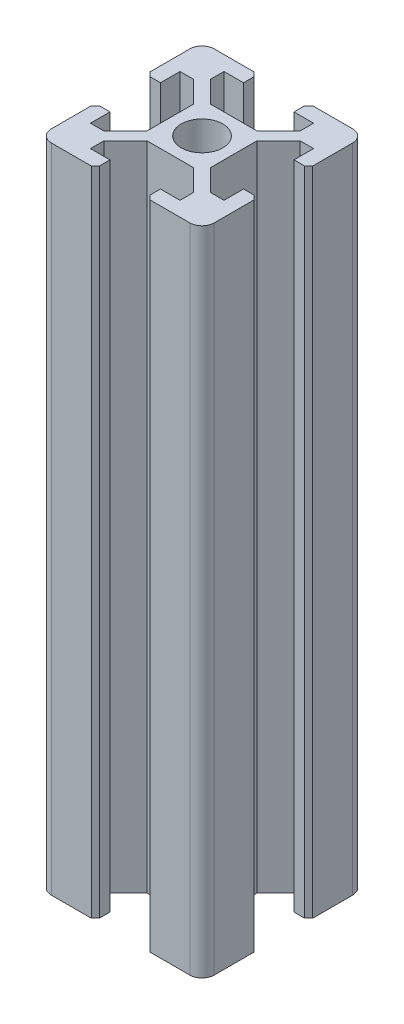
from build123d import *

# Parameters (mm, degrees)
EXTRUDE_2_DEPTH     = 80
SKETCH_4_R          = 2.55
CUT_EXTRUDE_2_DEPTH = 85.852813742


with BuildPart() as part:
    # 草图1 → 凸台-拉伸2 (new body)
    with BuildSketch(Plane(origin=(0, 0, 0), x_dir=(1, 0, 0), z_dir=(0, 1, 0))):
        with BuildLine():
            Line((13.9, 12.839339828), (13.9, 7.160660172))
            Line((13.9, 7.160660172), (16.560660172, 4.5))
            Line((16.560660172, 4.5), (18.2, 4.5))
            Line((18.2, 4.5), (18.2, 6.9))
            Line((18.2, 6.9), (19.5, 6.9))
            Line((19.5, 6.9), (20, 6.4))
            Line((20, 6.4), (20, 1.5))
            ThreePointArc((20, 1.5), (19.560660172, 0.439339828), (18.5, 0))
            Line((18.5, 0), (13.6, 0))
            Line((13.6, 0), (13.1, 0.5))
            Line((13.1, 0.5), (13.1, 1.8))
            Line((13.1, 1.8), (15.5, 1.8))
            Line((15.5, 1.8), (15.5, 3.439339828))
            Line((15.5, 3.439339828), (12.839339828, 6.1))
            Line((12.839339828, 6.1), (7.160660172, 6.1))
            Line((7.160660172, 6.1), (4.5, 3.439339828))
            Line((4.5, 3.439339828), (4.5, 1.8))
            Line((4.5, 1.8), (6.9, 1.8))
            Line((6.9, 1.8), (6.9, 0.5))
            Line((6.9, 0.5), (6.4, 0))
            Line((6.4, 0), (1.5, 0))
            ThreePointArc((1.5, 0), (0.439339828, 0.439339828), (0, 1.5))
            Line((0, 1.5), (0, 6.4))
            Line((0, 6.4), (0.5, 6.9))
            Line((0.5, 6.9), (1.8, 6.9))
            Line((1.8, 6.9), (1.8, 4.5))
            Line((1.8, 4.5), (3.439339828, 4.5))
            Line((3.439339828, 4.5), (6.1, 7.160660172))
            Line((6.1, 7.160660172), (6.1, 12.839339828))
            Line((6.1, 12.839339828), (3.439339828, 15.5))
            Line((3.439339828, 15.5), (1.8, 15.5))
            Line((1.8, 15.5), (1.8, 13.1))
            Line((1.8, 13.1), (0.5, 13.1))
            Line((0.5, 13.1), (0, 13.6))
            Line((0, 13.6), (0, 18.5))
            ThreePointArc((0, 18.5), (0.439339828, 19.560660172), (1.5, 20))
            Line((1.5, 20), (6.4, 20))
            Line((6.4, 20), (6.9, 19.5))
            Line((6.9, 19.5), (6.9, 18.2))
            Line((6.9, 18.2), (4.5, 18.2))
            Line((4.5, 18.2), (4.5, 16.560660172))
            Line((4.5, 16.560660172), (7.160660172, 13.9))
            Line((7.160660172, 13.9), (12.839339828, 13.9))
            Line((12.839339828, 13.9), (15.5, 16.560660172))
            Line((15.5, 16.560660172), (15.5, 18.2))
            Line((15.5, 18.2), (13.1, 18.2))
            Line((13.1, 18.2), (13.1, 19.5))
            Line((13.1, 19.5), (13.6, 20))
            Line((13.6, 20), (18.5, 20))
            ThreePointArc((18.5, 20), (19.560660172, 19.560660172), (20, 18.5))
            Line((20, 18.5), (20, 13.6))
            Line((20, 13.6), (19.5, 13.1))
            Line((19.5, 13.1), (18.2, 13.1))
            Line((18.2, 13.1), (18.2, 15.5))
            Line((18.2, 15.5), (16.560660172, 15.5))
            Line((16.560660172, 15.5), (13.9, 12.839339828))
        make_face()
    extrude(amount=EXTRUDE_2_DEPTH)

    # 草图4 → 切除-拉伸2 (cut, through all)
    with BuildSketch(Plane.XZ):
        with Locations(Location((10, -10, 0), (0, 0, 270))):
            Circle(SKETCH_4_R)
    extrude(amount=-CUT_EXTRUDE_2_DEPTH, mode=Mode.SUBTRACT)


solid = part.part
